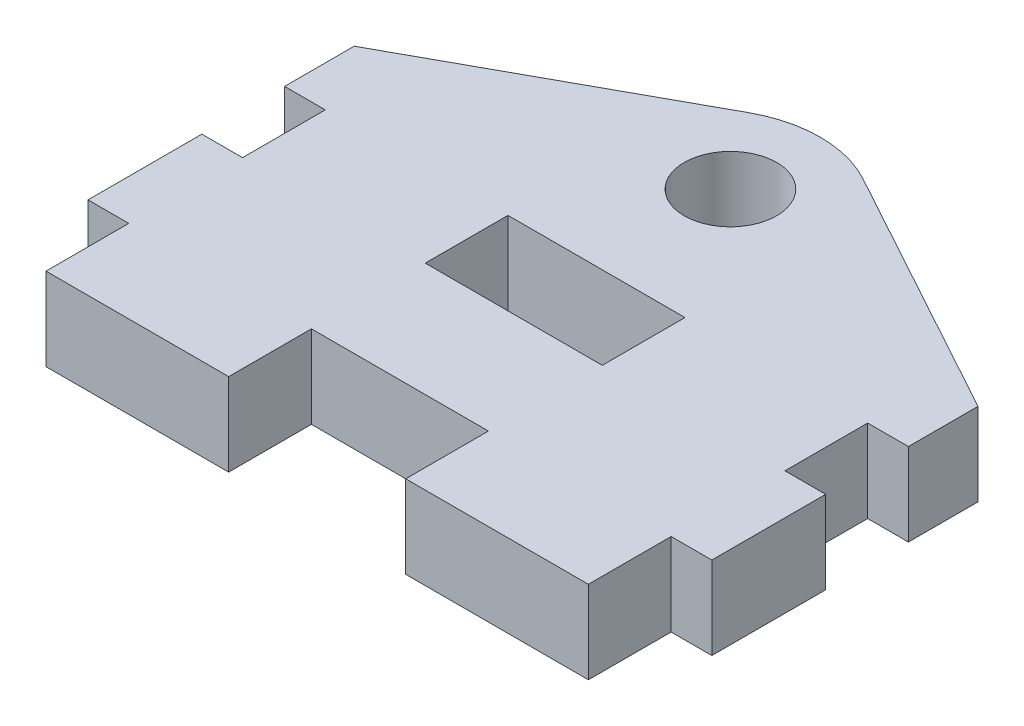
from build123d import *

# Parameters (mm, degrees)
SKETCH1_W                = 12.5
SKETCH1_H                = 5.842
BOSS_EXTRUDE2_DEPTH      = 5.842
F_0_257_DIAMETER_HOLE1_D = 6.5278
SKETCH4_W                = 3.175
SKETCH4_H                = 8.0375
SKETCH4_H_2              = 6.35
CUT_EXTRUDE1_DEPTH       = 60.128735202


with BuildPart() as part:
    # Sketch1 → Boss-Extrude2 (new body)
    with BuildSketch(Plane(origin=(0, 0, 0), x_dir=(1, 0, 0), z_dir=(0, 1, 0))):
        with BuildLine():
            Line((0, 0), (-6.45, 0))
            Line((-6.45, 0), (-6.45, -5.842))
            Line((-6.45, -5.842), (-19.35, -5.842))
            Line((-19.35, -5.842), (-19.35, 0))
            Line((-19.35, 0), (-31.85, 0))
            Line((-31.85, 0), (-31.85, -5.842))
            Line((-31.85, -5.842), (-44.75, -5.842))
            Line((-44.75, -5.842), (-44.75, 0))
            Line((-44.75, 0), (-50.8, 0))
            Line((-50.8, 0), (-50.8, 8.0375))
            Line((-50.8, 8.0375), (-44.75, 8.0375))
            Line((-44.75, 8.0375), (-44.75, 13.8795))
            Line((-44.75, 13.8795), (-50.8, 13.8795))
            Line((-50.8, 13.8795), (-50.8, 17.0545))
            Line((-50.8, 17.0545), (-29.639726031, 28.654387599))
            ThreePointArc((-29.639726031, 28.654387599), (-25.6, 29.689027646), (-21.560273969, 28.654387599))
            Line((-21.560273969, 28.654387599), (-0.4, 17.0545))
            Line((-0.4, 17.0545), (-0.4, 13.8795))
            Line((-0.4, 13.8795), (-6.45, 13.8795))
            Line((-6.45, 13.8795), (-6.45, 8.0375))
            Line((-6.45, 8.0375), (0, 8.0375))
            Line((0, 8.0375), (0, 0))
        make_face()
        with Locations((-25.6, 10.9585)):
            Rectangle(SKETCH1_W, SKETCH1_H, mode=Mode.SUBTRACT)
    extrude(amount=BOSS_EXTRUDE2_DEPTH)

    # F (0.257) Diameter Hole1 (through all)
    with Locations(Plane(origin=(0, 5.842, 0), x_dir=(1, 0, 0), z_dir=(0, 1, 0))):
        with Locations((-25.6, 23.339027646)):
            Hole(F_0_257_DIAMETER_HOLE1_D / 2)

    # Sketch4 → Cut-Extrude1 (cut, through all)
    with BuildSketch(Plane(origin=(0, 5.842, 0), x_dir=(1, 0, 0), z_dir=(0, 1, 0))):
        with Locations((-49.2125, 4.01875)):
            Rectangle(SKETCH4_W, SKETCH4_H)
        Polygon((-3.575, 9.495445591), (-3.575, 0), (-0.4, 0), (0, 0), (0, 9.495445591), (-0.4, 9.495445591), align=None)
        with Locations((-49.2125, 17.0545)):
            Rectangle(SKETCH4_W, SKETCH4_H_2)
        with Locations((-1.9875, 16.9545)):
            Rectangle(SKETCH4_W, SKETCH4_H_2)
    extrude(amount=-CUT_EXTRUDE1_DEPTH, mode=Mode.SUBTRACT)


solid = part.part
